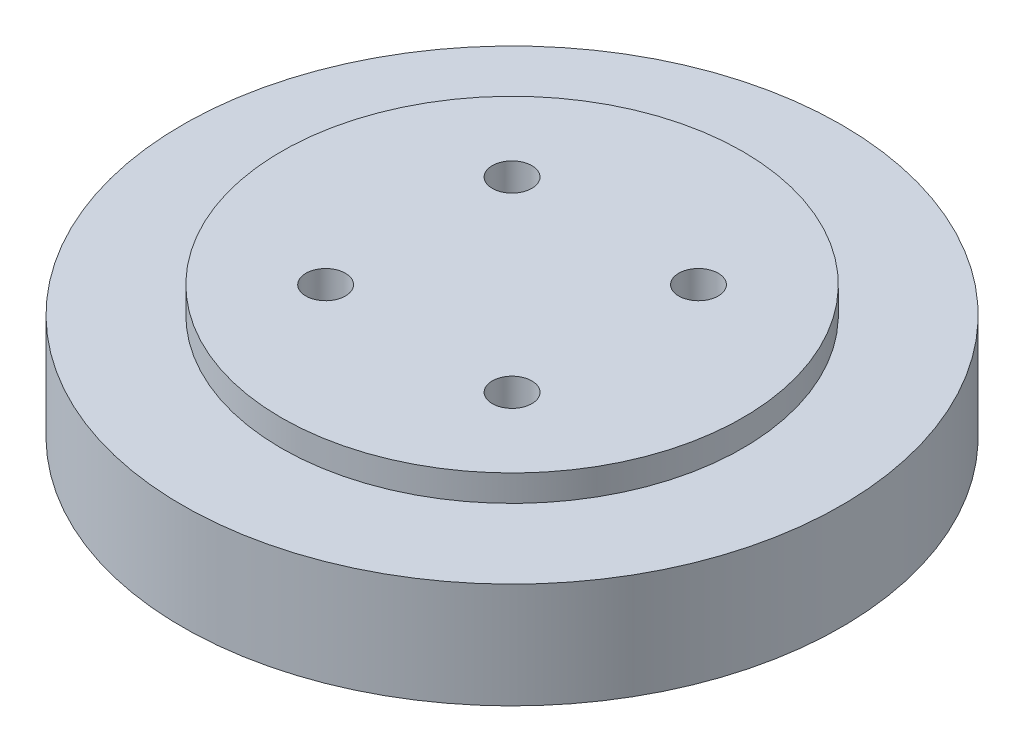
from build123d import *

# Parameters (mm, degrees)
SKETCH3_R          = 1.5
CUT_EXTRUDE1_DEPTH = 37.742346142
CIRPATTERN1_COUNT  = 4
CUT_EXTRUDE2_START = -7
CUT_EXTRUDE2_DEPTH = 7
CIRPATTERN2_COUNT  = 6


with BuildPart() as part:
    # Sketch2 → Revolve1 (revolve)
    with BuildSketch(Plane.XY, mode=Mode.PRIVATE) as revolve1_sk:
        Polygon((0, 0), (7, 0), (7, 7), (24, 7), (24, 0), (25, 0), (25, 8), (17.5, 8), (17.5, 10), (0, 10), align=None)
    revolve(revolve1_sk.sketch.rotate(Axis((0, 0, 0), (0, 1, 0)), 90), axis=Axis((0, 0, 0), (0, 1, 0)))

    # Sketch3 → Cut-Extrude1 (cut, through all)
    with BuildSketch(Plane(origin=(0, 10, 0), x_dir=(1, 0, 0), z_dir=(0, 1, 0))):
        with Locations(Location((-7.071067812, 7.071067812, 0), (0, 0, 270))):
            Circle(SKETCH3_R)
    cut_extrude1 = extrude(amount=-CUT_EXTRUDE1_DEPTH, mode=Mode.SUBTRACT)

    # CirPattern1: Cut-Extrude1 ×4 about axis
    cirpattern1_axis = Axis((0, 0, 0), (0, 1, 0))
    for i in range(1, CIRPATTERN1_COUNT):
        add(cut_extrude1.rotate(cirpattern1_axis, i * 360 / CIRPATTERN1_COUNT), mode=Mode.SUBTRACT)

    # Sketch4 → Cut-Extrude2 (cut)
    with BuildSketch(Plane.XZ.offset(CUT_EXTRUDE2_START)):
        with BuildLine():
            Line((-1.215537244, 6.893654271), (-1.041889066, 5.908846518))
            ThreePointArc((-1.041889066, 5.908846518), (0, 6), (1.041889066, 5.908846518))
            Line((1.041889066, 5.908846518), (1.215537244, 6.893654271))
            ThreePointArc((1.215537244, 6.893654271), (0, 7), (-1.215537244, 6.893654271))
        make_face()
    cut_extrude2 = extrude(amount=CUT_EXTRUDE2_DEPTH, mode=Mode.SUBTRACT)

    # CirPattern2: Cut-Extrude2 ×6 about axis
    cirpattern2_axis = Axis((0, 0, 0), (0, 1, 0))
    for i in range(1, CIRPATTERN2_COUNT):
        add(cut_extrude2.rotate(cirpattern2_axis, i * 360 / CIRPATTERN2_COUNT), mode=Mode.SUBTRACT)


solid = part.part
